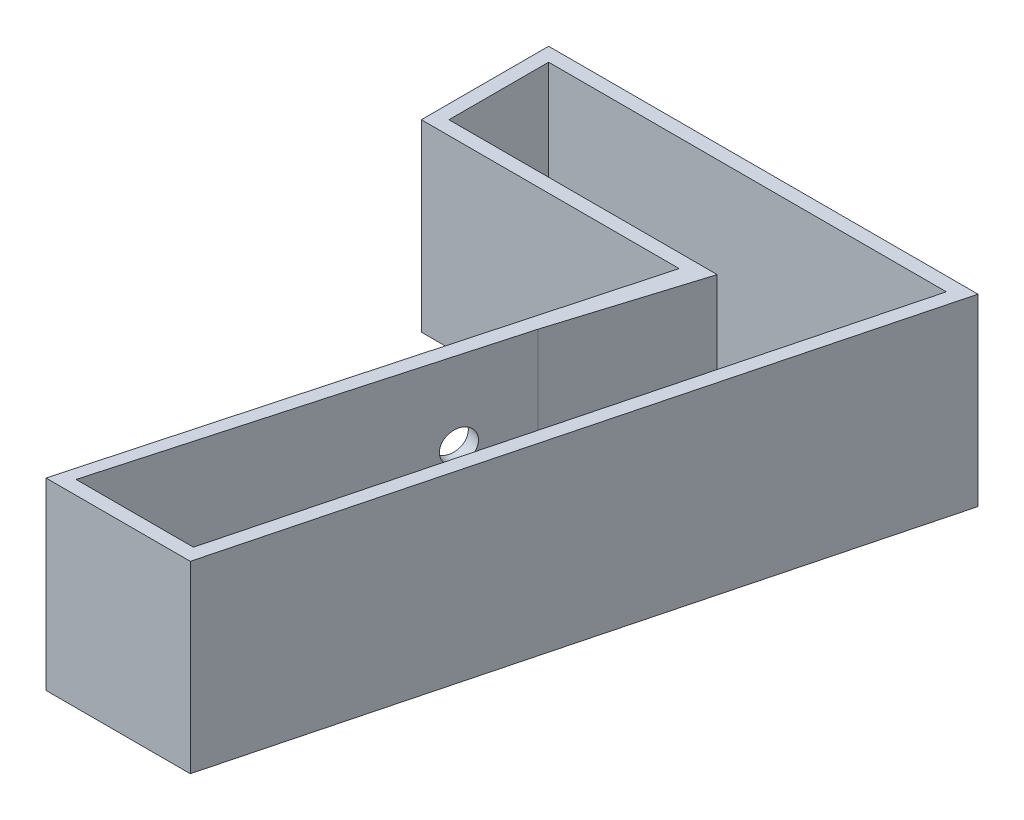
from build123d import *

# Parameters (mm, degrees)
BOSS_EXTRUDE1_DEPTH = 40
CUT_EXTRUDE1_DEPTH  = 111.966839961
SKETCH6_R           = 3.45
CUT_EXTRUDE2_DEPTH  = 10
SKETCH7_R           = 2.75
BOSS_EXTRUDE3_DEPTH = 4.02
SKETCH8_R           = 2.225
CUT_EXTRUDE3_DEPTH  = 110.581932685


with BuildPart() as part:
    # Sketch1 → Boss-Extrude1 (new body)
    with BuildSketch(Plane(origin=(0, 0, 0), x_dir=(1, 0, 0), z_dir=(0, 1, 0))):
        Polygon((-32.806430064, 51.994551896), (60.552740485, 51.994551896), (25.225039266, -83.946442395), (-6.149932227, -83.946442395), (23.249976258, 24.323717363), (-32.806430064, 24.323717363), align=None)
    extrude(amount=BOSS_EXTRUDE1_DEPTH)

    # Sketch3 → Cut-Extrude1 (cut, through all)
    with BuildSketch(Plane(origin=(0, 40, 0), x_dir=(1, 0, 0), z_dir=(0, 1, 0))):
        Polygon((56.180799988, 48.994551896), (56.673466926, 48.994551896), (56.129977884, 46.90320606), (22.905017266, -80.946442395), (-2.608781808, -80.946442395), (19.305922239, -2.461259631), (28.517713947, 27.323717363), (-29.806430064, 27.323717363), (-29.806430064, 48.994551896), (-0.992743821, 48.994551896), align=None)
    extrude(amount=-CUT_EXTRUDE1_DEPTH, mode=Mode.SUBTRACT)

    # Sketch6 → Cut-Extrude2 (cut)
    with BuildSketch(Plane(origin=(15.502019252, 0, 4.209451139), x_dir=(-0.2620526895610605, 0, 0.9650535673701303), z_dir=(-0.9650535673701304, 0, -0.2620526895610605))):
        with Locations((11.246173588, 22.801195515)):
            Circle(SKETCH6_R)
    extrude(amount=-CUT_EXTRUDE2_DEPTH, mode=Mode.SUBTRACT)

    # Sketch7 → Boss-Extrude3 (add)
    with BuildSketch(Plane(origin=(0, 0, 0), x_dir=(1, 0, 0), z_dir=(0, 1, 0))):
        with Locations(Location((-17.598579061, 46.230759465, 0), (0, 0, 270))):
            Circle(SKETCH7_R)
        with Locations((45.885843259, 18.385111047)):
            Circle(SKETCH7_R)
        with Locations(Location((7.758668696, -54.160966994, 0), (0, 0, 270))):
            Circle(SKETCH7_R)
    extrude(amount=BOSS_EXTRUDE3_DEPTH)


with BuildPart() as boss_extrude3_piece_1:
    # of the separate pieces the step leaves, piece 1, a body of its own (boss_extrude3_pieces)
    add(part.part.solids().sort_by_distance((-32.806430064, 0, -51.994551896))[0])


with BuildPart() as boss_extrude3_piece_2:
    # of the separate pieces the step leaves, piece 2, a body of its own (boss_extrude3_pieces)
    add(part.part.solids().sort_by_distance((7.758668696, 0, 56.910966994))[0])


with BuildPart() as boss_extrude3_piece_3:
    # of the separate pieces the step leaves, piece 3, a body of its own (boss_extrude3_pieces)
    add(part.part.solids().sort_by_distance((-17.598579061, 0, -43.480759465))[0])


with BuildPart() as cut_extrude3_tool:
    # Sketch8 → Cut-Extrude3 (new, through all)
    with BuildSketch(Plane(origin=(0, 4.02, 0), x_dir=(1, 0, 0), z_dir=(0, 1, 0))):
        with Locations(Location((-17.598579061, 46.230759465, 0), (0, 0, 270))):
            Circle(SKETCH8_R)
        with Locations(Location((45.885843259, 18.385111047, 0), (0, 0, 270))):
            Circle(SKETCH8_R)
        with Locations(Location((7.758668696, -54.160966994, 0), (0, 0, 270))):
            Circle(SKETCH8_R)
    extrude(amount=-CUT_EXTRUDE3_DEPTH)


with BuildPart() as boss_extrude3_piece_1_1:
    add(boss_extrude3_piece_1.part)

    # Cut-Extrude3: cut by cut_extrude3_tool
    add(cut_extrude3_tool.part, mode=Mode.SUBTRACT)


with BuildPart() as boss_extrude3_piece_2_1:
    add(boss_extrude3_piece_2.part)

    # Cut-Extrude3: cut by cut_extrude3_tool
    add(cut_extrude3_tool.part, mode=Mode.SUBTRACT)


with BuildPart() as boss_extrude3_piece_3_1:
    add(boss_extrude3_piece_3.part)

    # Cut-Extrude3: cut by cut_extrude3_tool
    add(cut_extrude3_tool.part, mode=Mode.SUBTRACT)


solid = Compound([boss_extrude3_piece_1_1.part, boss_extrude3_piece_2_1.part, boss_extrude3_piece_3_1.part])
